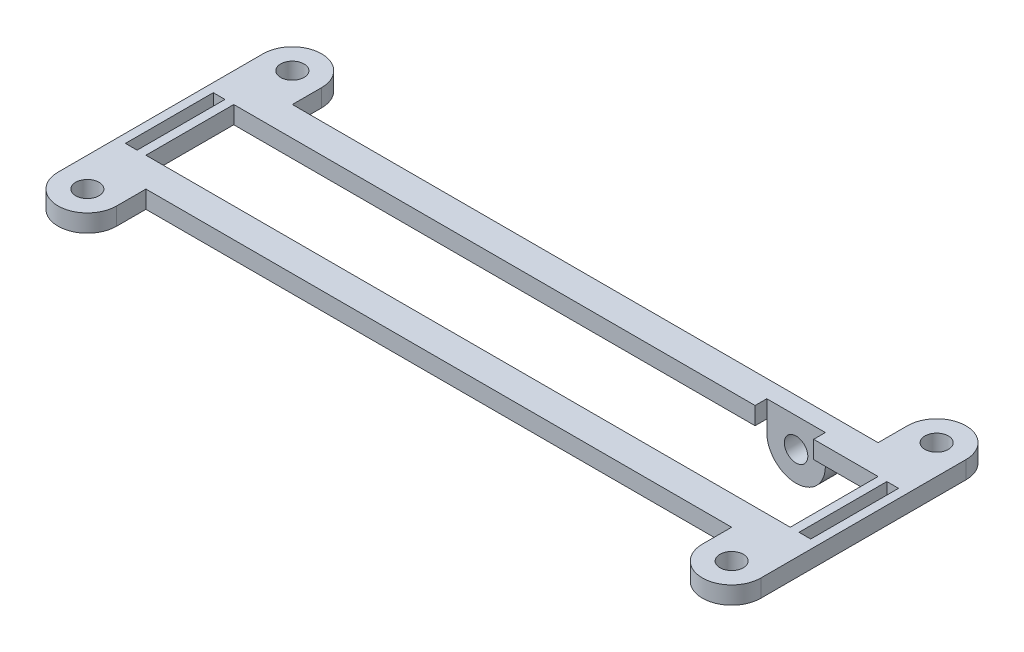
from build123d import *

# Parameters (mm, degrees)
SKETCH1_R           = 5
SKETCH1_R_2         = 2
SKETCH1_W           = 120
SKETCH1_H           = 25
SKETCH1_W_2         = 110
SKETCH1_H_2         = 15
BOSS_EXTRUDE1_DEPTH = 3
SKETCH2_W           = 2
SKETCH2_H           = 15
CUT_EXTRUDE1_DEPTH  = 3
SKETCH3_R           = 2
BOSS_EXTRUDE3_DEPTH = 3
SKETCH4_W           = 10
SKETCH4_H           = 3
CUT_EXTRUDE2_DEPTH  = 2


with BuildPart() as part:
    # Sketch1 → Boss-Extrude1 (new body)
    # profile 1 of 13: a face of its own
    with BuildSketch(Plane(origin=(0, 0, 0), x_dir=(1, 0, 0), z_dir=(0, 1, 0))):
        with Locations((5, 30)):
            Circle(SKETCH1_R)
        with Locations(Location((5, 30, 0), (0, 0, 270))):
            Circle(SKETCH1_R_2, mode=Mode.SUBTRACT)
    # profile 2 of 13: a face of its own
    with BuildSketch(Plane(origin=(0, 0, 0), x_dir=(1, 0, 0), z_dir=(0, 1, 0))):
        with BuildLine():
            Line((0, 30), (0, 25))
            Line((0, 25), (5, 25))
            ThreePointArc((5, 25), (1.464466094, 26.464466094), (0, 30))
        make_face()
    # profile 3 of 13: a face of its own
    with BuildSketch(Plane(origin=(0, 0, 0), x_dir=(1, 0, 0), z_dir=(0, 1, 0))):
        with BuildLine():
            ThreePointArc((10, 30), (8.535533906, 26.464466094), (5, 25))
            Line((5, 25), (10, 25))
            Line((10, 25), (10, 30))
        make_face()
    # profile 4 of 13: a face of its own
    with BuildSketch(Plane(origin=(0, 0, 0), x_dir=(1, 0, 0), z_dir=(0, 1, 0))):
        with Locations((60, 12.5)):
            Rectangle(SKETCH1_W, SKETCH1_H)
        with Locations((60, 12.5)):
            Rectangle(SKETCH1_W_2, SKETCH1_H_2, mode=Mode.SUBTRACT)
    # profile 5 of 13: a face of its own
    with BuildSketch(Plane(origin=(0, 0, 0), x_dir=(1, 0, 0), z_dir=(0, 1, 0))):
        with BuildLine():
            Line((5, 0), (0, 0))
            Line((0, 0), (0, -5))
            ThreePointArc((0, -5), (1.464466094, -1.464466094), (5, 0))
        make_face()
    # profile 6 of 13: a face of its own
    with BuildSketch(Plane(origin=(0, 0, 0), x_dir=(1, 0, 0), z_dir=(0, 1, 0))):
        with BuildLine():
            Line((10, 0), (5, 0))
            ThreePointArc((5, 0), (8.535533906, -1.464466094), (10, -5))
            Line((10, -5), (10, 0))
        make_face()
    # profile 7 of 13: a face of its own
    with BuildSketch(Plane(origin=(0, 0, 0), x_dir=(1, 0, 0), z_dir=(0, 1, 0))):
        with Locations((5, -5)):
            Circle(SKETCH1_R)
        with Locations(Location((5, -5, 0), (0, 0, 270))):
            Circle(SKETCH1_R_2, mode=Mode.SUBTRACT)
    # profile 8 of 13: a face of its own
    with BuildSketch(Plane(origin=(0, 0, 0), x_dir=(1, 0, 0), z_dir=(0, 1, 0))):
        with BuildLine():
            Line((110, 30), (110, 25))
            Line((110, 25), (115, 25))
            ThreePointArc((115, 25), (111.464466094, 26.464466094), (110, 30))
        make_face()
    # profile 9 of 13: a face of its own
    with BuildSketch(Plane(origin=(0, 0, 0), x_dir=(1, 0, 0), z_dir=(0, 1, 0))):
        with Locations((115, 30)):
            Circle(SKETCH1_R)
        with Locations(Location((115, 30, 0), (0, 0, 270))):
            Circle(SKETCH1_R_2, mode=Mode.SUBTRACT)
    # profile 10 of 13: a face of its own
    with BuildSketch(Plane(origin=(0, 0, 0), x_dir=(1, 0, 0), z_dir=(0, 1, 0))):
        with BuildLine():
            ThreePointArc((120, 30), (118.535533906, 26.464466094), (115, 25))
            Line((115, 25), (120, 25))
            Line((120, 25), (120, 30))
        make_face()
    # profile 11 of 13: a face of its own
    with BuildSketch(Plane(origin=(0, 0, 0), x_dir=(1, 0, 0), z_dir=(0, 1, 0))):
        with BuildLine():
            Line((115, 0), (110, 0))
            Line((110, 0), (110, -5))
            ThreePointArc((110, -5), (111.464466094, -1.464466094), (115, 0))
        make_face()
    # profile 12 of 13: a face of its own
    with BuildSketch(Plane(origin=(0, 0, 0), x_dir=(1, 0, 0), z_dir=(0, 1, 0))):
        with BuildLine():
            Line((120, 0), (115, 0))
            ThreePointArc((115, 0), (118.535533906, -1.464466094), (120, -5))
            Line((120, -5), (120, 0))
        make_face()
    # profile 13 of 13: a face of its own
    with BuildSketch(Plane(origin=(0, 0, 0), x_dir=(1, 0, 0), z_dir=(0, 1, 0))):
        with Locations((115, -5)):
            Circle(SKETCH1_R)
        with Locations(Location((115, -5, 0), (0, 0, 270))):
            Circle(SKETCH1_R_2, mode=Mode.SUBTRACT)
    extrude(amount=BOSS_EXTRUDE1_DEPTH)

    # Sketch2 → Cut-Extrude1 (cut)
    with BuildSketch(Plane(origin=(0, 3, 0), x_dir=(1, 0, 0), z_dir=(0, 1, 0))):
        with Locations((117.5, 12.5)):
            Rectangle(SKETCH2_W, SKETCH2_H)
        with Locations((2.5, 12.5)):
            Rectangle(SKETCH2_W, SKETCH2_H)
    extrude(amount=-CUT_EXTRUDE1_DEPTH, mode=Mode.SUBTRACT)

    # Sketch3 → Boss-Extrude3 (add)
    # profile 1 of 3: a face of its own
    with BuildSketch(Plane(origin=(0, 0, -25), x_dir=(-1, 0, 0), z_dir=(0, 0, -1))):
        with BuildLine():
            ThreePointArc((-103.578198336, 0), (-103.893413516, -0.98310947), (-104, -2.01))
            ThreePointArc((-104, -2.01), (-99, -7.01), (-94, -2.01))
            ThreePointArc((-94, -2.01), (-94.106586484, -0.98310947), (-94.421801664, 0))
            Line((-94.421801664, 0), (-103.578198336, 0))
        make_face()
        with Locations((-99, -2.01)):
            Circle(SKETCH3_R, mode=Mode.SUBTRACT)
    # profile 2 of 3: a face of its own
    with BuildSketch(Plane(origin=(0, 0, -25), x_dir=(-1, 0, 0), z_dir=(0, 0, -1))):
        with BuildLine():
            ThreePointArc((-94.421801664, 0), (-94.106586484, -0.98310947), (-94, -2.01))
            Line((-94, -2.01), (-94, 0))
            Line((-94, 0), (-94.421801664, 0))
        make_face()
    # profile 3 of 3: a face of its own
    with BuildSketch(Plane(origin=(0, 0, -25), x_dir=(-1, 0, 0), z_dir=(0, 0, -1))):
        with BuildLine():
            Line((-104, 0), (-104, -2.01))
            ThreePointArc((-104, -2.01), (-103.893413516, -0.98310947), (-103.578198336, 0))
            Line((-103.578198336, 0), (-104, 0))
        make_face()
    extrude(amount=-BOSS_EXTRUDE3_DEPTH)

    # Sketch4 → Cut-Extrude2 (cut)
    with BuildSketch(Plane.XY.offset(-20)):
        with Locations((99, 1.5)):
            Rectangle(SKETCH4_W, SKETCH4_H)
    extrude(amount=-CUT_EXTRUDE2_DEPTH, mode=Mode.SUBTRACT)


solid = part.part
